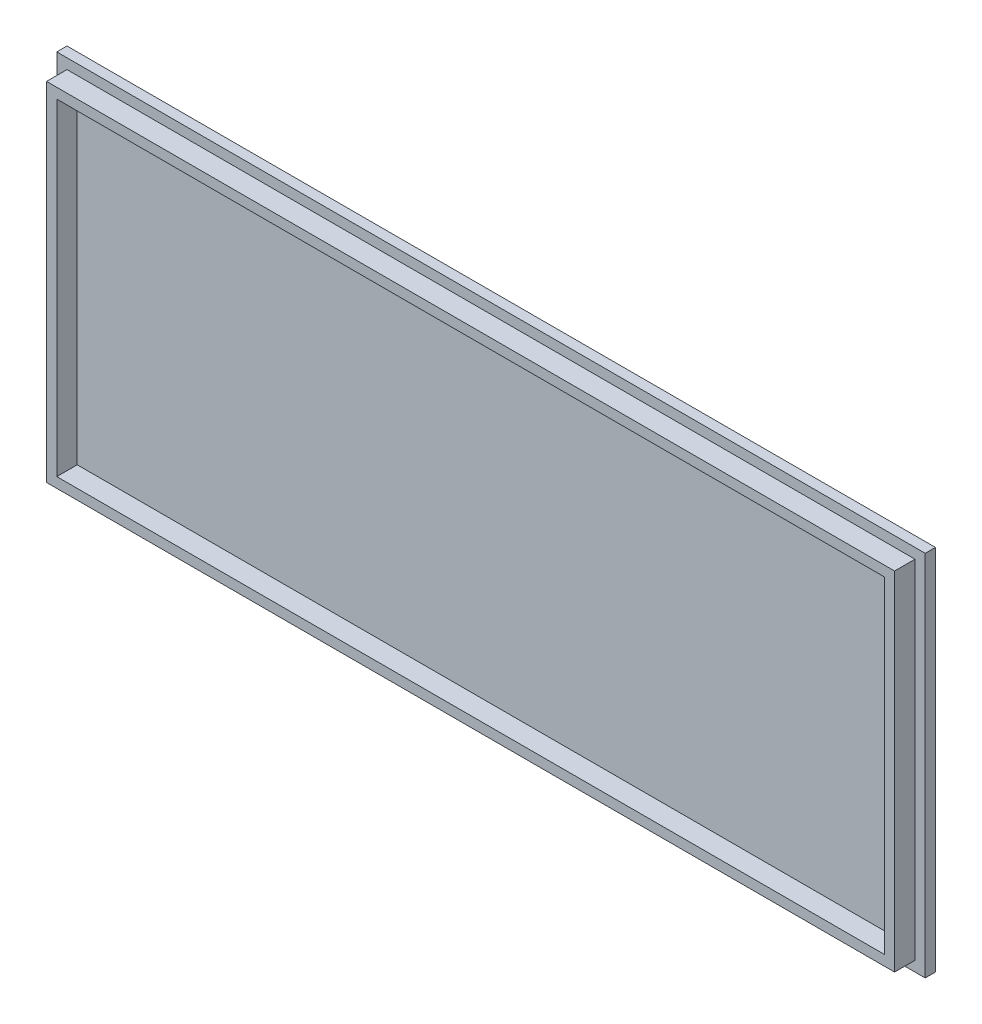
from build123d import *

# Parameters (mm, degrees)
SKIZZE1_W                       = 85
SKIZZE1_H                       = 36
AUFSATZ_LINEAR_AUSTRAGEN1_DEPTH = 1
SKIZZE2_W                       = 83
SKIZZE2_H                       = 34
SKIZZE2_W_2                     = 81
SKIZZE2_H_2                     = 32
AUFSATZ_LINEAR_AUSTRAGEN2_DEPTH = 2


with BuildPart() as part:
    # Skizze1 → Aufsatz-Linear austragen1 (new body)
    with BuildSketch(Plane.XY):
        with Locations((-42.5, 18)):
            Rectangle(SKIZZE1_W, SKIZZE1_H)
    extrude(amount=AUFSATZ_LINEAR_AUSTRAGEN1_DEPTH)

    # Skizze2 → Aufsatz-Linear austragen2 (add)
    with BuildSketch(Plane.XY.offset(1)):
        with Locations((-42.5, 18)):
            Rectangle(SKIZZE2_W, SKIZZE2_H)
        with Locations((-42.5, 18)):
            Rectangle(SKIZZE2_W_2, SKIZZE2_H_2, mode=Mode.SUBTRACT)
    extrude(amount=AUFSATZ_LINEAR_AUSTRAGEN2_DEPTH)


solid = part.part
